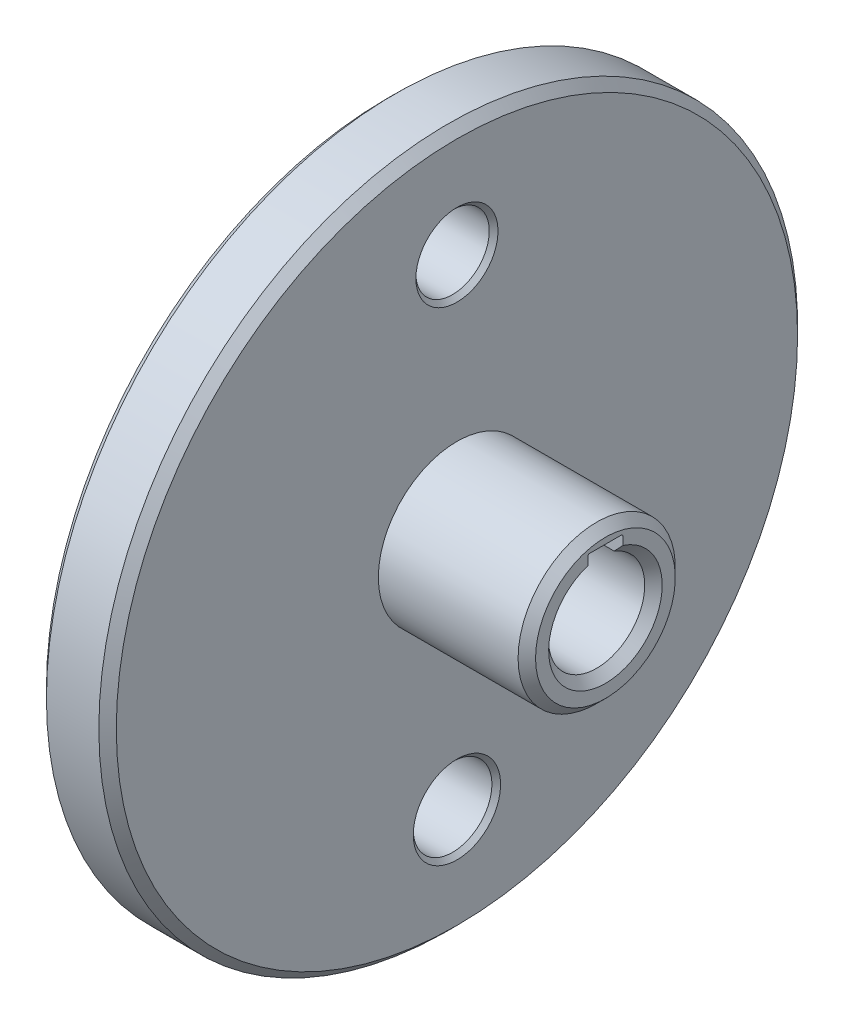
from build123d import *

# Parameters (mm, degrees)
SKETCH_2_R          = 4.2
CUT_EXTRUDE_1_DEPTH = 62.846584384
SKETCH_3_R          = 4.5
CUT_EXTRUDE_2_DEPTH = 62.846584384
SKETCH_5_W          = 4
SKETCH_5_H          = 4
CUT_EXTRUDE_3_DEPTH = 62.846584384
FILLET_1_R          = 0.2
CHAMFER_1_SIZE      = 1
CHAMFER_2_SIZE      = 0.5


with BuildPart() as part:
    # Эскиз1 → Повернуть1 (revolve)
    with BuildSketch(Plane.XY, mode=Mode.PRIVATE) as revolve_1_sk:
        Polygon((0, 12.5), (0, 40), (8, 40), (8, 9), (25, 9), (25, 5.5), (2, 5.5), (2, 12.5), align=None)
    revolve(revolve_1_sk.sketch.rotate(Axis((0, 0, 0), (1, 0, 0)), 90), axis=Axis((0, 0, 0), (1, 0, 0)))

    # Эскиз2 → Вырез-Вытянуть1 (cut, through all)
    with BuildSketch(Plane(origin=(0, 0, 0), x_dir=(0, 0, -1), z_dir=(1, 0, 0))):
        with Locations(Location((0, 27.5, 0), (0, 0, 180))):
            Circle(SKETCH_2_R)
    extrude(amount=CUT_EXTRUDE_1_DEPTH, mode=Mode.SUBTRACT)

    # Эскиз3 → Вырез-Вытянуть2 (cut, through all)
    with BuildSketch(Plane(origin=(0, 0, 0), x_dir=(0, 0, -1), z_dir=(1, 0, 0))):
        with Locations(Location((0, -27.5, 0), (0, 0, 180))):
            Circle(SKETCH_3_R)
    extrude(amount=CUT_EXTRUDE_2_DEPTH, mode=Mode.SUBTRACT)

    # Эскиз5 → Вырез-Вытянуть3 (cut, through all)
    with BuildSketch(Plane(origin=(0, 0, 0), x_dir=(0, 0, -1), z_dir=(1, 0, 0))):
        with Locations((0, 5.3)):
            Rectangle(SKETCH_5_W, SKETCH_5_H)
    extrude(amount=CUT_EXTRUDE_3_DEPTH, mode=Mode.SUBTRACT)

    # Скругление1
    fillet_1_edges = [part.edges().sort_by_distance(p)[0] for p in [
        (13.5, 7.3, -2),
        (13.5, 7.3, 2),
    ]]
    fillet(fillet_1_edges, radius=FILLET_1_R)

    # Фаска1
    chamfer_1_edges = [part.edges().sort_by_distance(p)[0] for p in [
        (25, -5.5, 0),
        (25, 0, -9),
        (8, 0, -40),
        (0, 0, -40),
    ]]
    chamfer(chamfer_1_edges, length=CHAMFER_1_SIZE)

    # Фаска2
    chamfer_2_edges = [part.edges().sort_by_distance(p)[0] for p in [
        (8, 27.5, -4.2),
        (8, -27.5, -4.5),
    ]]
    chamfer(chamfer_2_edges, length=CHAMFER_2_SIZE)


solid = part.part
